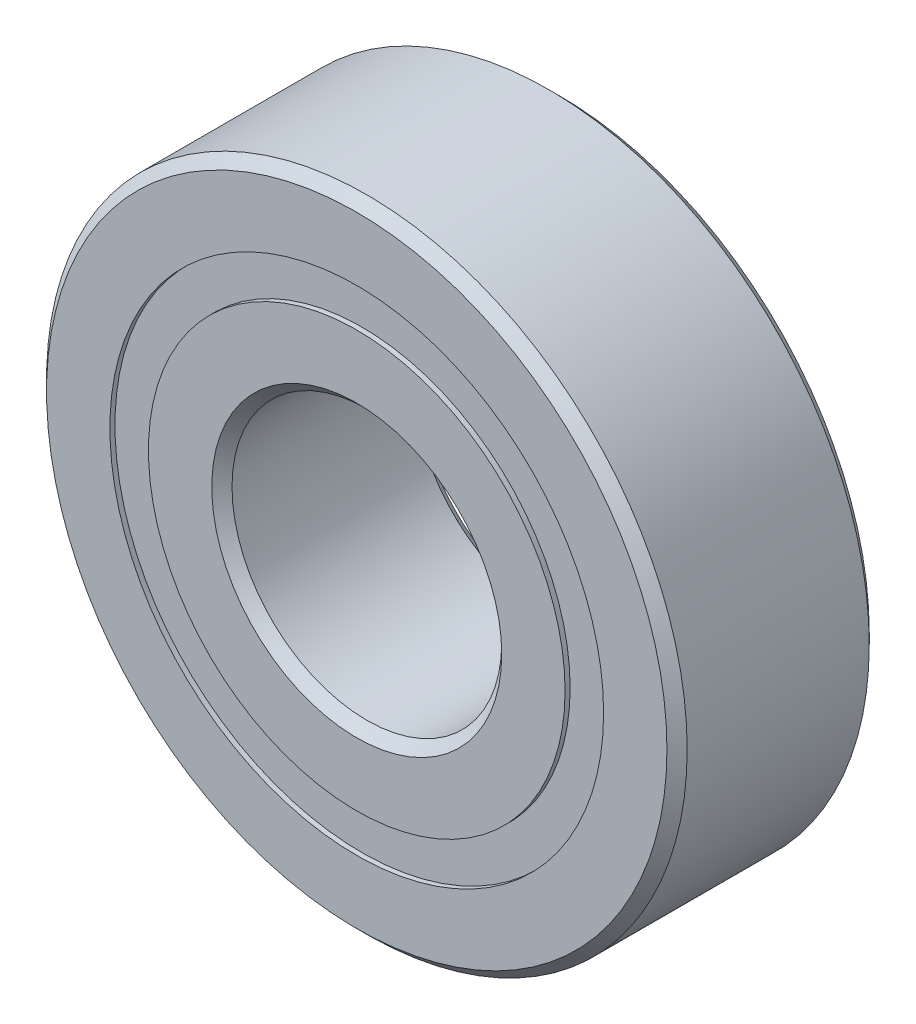
from build123d import *

# Parameters (mm, degrees)
CIRPATTERN1_COUNT = 12
SKETCH5_W         = 1.399376551
SKETCH5_H         = 1.142857142


with BuildPart() as part:
    # Sketch1 → Revolve1 (revolve)
    with BuildSketch(Plane(origin=(0, 0, 0), x_dir=(0, 0, -1), z_dir=(1, 0, 0))):
        with BuildLine():
            Line((2.7, 9.5), (-2.7, 9.5))
            Line((-2.7, 9.5), (-3, 9.2))
            Line((-3, 9.2), (-3, 7.321428571))
            Line((-3, 7.321428571), (-1.333333333, 7.321428571))
            ThreePointArc((-1.333333333, 7.321428571), (0, 8.200623449), (1.333333333, 7.321428571))
            Line((1.333333333, 7.321428571), (3, 7.321428571))
            Line((3, 7.321428571), (3, 9.2))
            Line((3, 9.2), (2.7, 9.5))
        make_face()
    revolve(axis=Axis((0, 0, 3), (0, 0, -1)))


with BuildPart() as body_2:
    # Sketch3 → Revolve3 (revolve)
    with BuildSketch(Plane(origin=(0, 0, 0), x_dir=(0, 0, -1), z_dir=(1, 0, 0))):
        with BuildLine():
            Line((-3, 6.178571429), (-1.333333333, 6.178571429))
            ThreePointArc((-1.333333333, 6.178571429), (0, 5.299376551), (1.333333333, 6.178571429))
            Line((1.333333333, 6.178571429), (3, 6.178571429))
            Line((3, 6.178571429), (3, 4.3))
            Line((3, 4.3), (2.7, 4))
            Line((2.7, 4), (-2.7, 4))
            Line((-2.7, 4), (-3, 4.3))
            Line((-3, 4.3), (-3, 6.178571429))
        make_face()
    revolve(axis=Axis((0, 0, 3), (0, 0, -1)))


with BuildPart() as body_3:
    # Sketch4 → Revolve4 (revolve)
    with BuildSketch(Plane(origin=(0, 0, 0), x_dir=(0, 0, -1), z_dir=(1, 0, 0))):
        with BuildLine():
            Line((-1.450623449, 6.75), (1.450623449, 6.75))
            ThreePointArc((1.450623449, 6.75), (0, 8.200623449), (-1.450623449, 6.75))
        make_face()
    revolve(axis=Axis((0, 6.75, 1.450623449), (0, 0, -1)))


with BuildPart() as cirpattern1_1:
    # CirPattern1: pattern copy
    add(body_3.part.rotate(Axis((0, 0, -3), (0, 0, 1)), 1 * 360 / CIRPATTERN1_COUNT))


with BuildPart() as cirpattern1_2:
    # CirPattern1: pattern copy
    add(body_3.part.rotate(Axis((0, 0, -3), (0, 0, 1)), 2 * 360 / CIRPATTERN1_COUNT))


with BuildPart() as cirpattern1_3:
    # CirPattern1: pattern copy
    add(body_3.part.rotate(Axis((0, 0, -3), (0, 0, 1)), 3 * 360 / CIRPATTERN1_COUNT))


with BuildPart() as cirpattern1_4:
    # CirPattern1: pattern copy
    add(body_3.part.rotate(Axis((0, 0, -3), (0, 0, 1)), 4 * 360 / CIRPATTERN1_COUNT))


with BuildPart() as cirpattern1_5:
    # CirPattern1: pattern copy
    add(body_3.part.rotate(Axis((0, 0, -3), (0, 0, 1)), 5 * 360 / CIRPATTERN1_COUNT))


with BuildPart() as cirpattern1_6:
    # CirPattern1: pattern copy
    add(body_3.part.rotate(Axis((0, 0, -3), (0, 0, 1)), 6 * 360 / CIRPATTERN1_COUNT))


with BuildPart() as cirpattern1_7:
    # CirPattern1: pattern copy
    add(body_3.part.rotate(Axis((0, 0, -3), (0, 0, 1)), 7 * 360 / CIRPATTERN1_COUNT))


with BuildPart() as cirpattern1_8:
    # CirPattern1: pattern copy
    add(body_3.part.rotate(Axis((0, 0, -3), (0, 0, 1)), 8 * 360 / CIRPATTERN1_COUNT))


with BuildPart() as cirpattern1_9:
    # CirPattern1: pattern copy
    add(body_3.part.rotate(Axis((0, 0, -3), (0, 0, 1)), 9 * 360 / CIRPATTERN1_COUNT))


with BuildPart() as cirpattern1_10:
    # CirPattern1: pattern copy
    add(body_3.part.rotate(Axis((0, 0, -3), (0, 0, 1)), 10 * 360 / CIRPATTERN1_COUNT))


with BuildPart() as cirpattern1_11:
    # CirPattern1: pattern copy
    add(body_3.part.rotate(Axis((0, 0, -3), (0, 0, 1)), 11 * 360 / CIRPATTERN1_COUNT))


with BuildPart() as body_15:
    # Sketch5 → Revolve5 (revolve)
    with BuildSketch(Plane(origin=(0, 0, 0), x_dir=(0, 0, -1), z_dir=(1, 0, 0))):
        with Locations((-2.150311724, 6.75)):
            Rectangle(SKETCH5_W, SKETCH5_H)
        with Locations((2.150311724, 6.75)):
            Rectangle(SKETCH5_W, SKETCH5_H)
    revolve(axis=Axis((0, 0, 3), (0, 0, -1)))


solid = Compound([part.part, body_2.part, body_3.part, cirpattern1_1.part, cirpattern1_2.part, cirpattern1_3.part, cirpattern1_4.part, cirpattern1_5.part, cirpattern1_6.part, cirpattern1_7.part, cirpattern1_8.part, cirpattern1_9.part, cirpattern1_10.part, cirpattern1_11.part, body_15.part])
